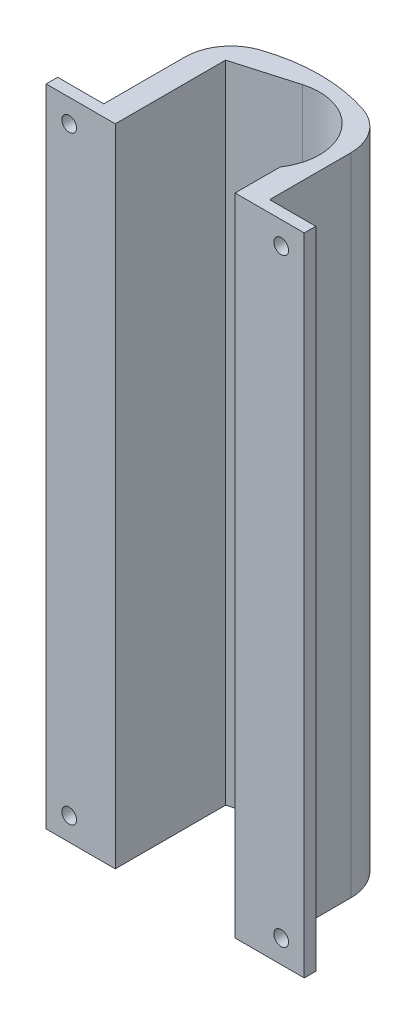
from build123d import *

# Parameters (mm, degrees)
BOSS_EXTRUDE1_DEPTH = 177.8
FILLET2_R           = 12.7
SKETCH2_R           = 2.032
CUT_EXTRUDE1_DEPTH  = 186.827403736


with BuildPart() as part:
    # Sketch1 → Boss-Extrude1 (new body)
    with BuildSketch(Plane(origin=(0, 0, 0), x_dir=(1, 0, 0), z_dir=(0, 1, 0))):
        with BuildLine():
            Line((12.446, -95.666893232), (12.446, -83.267976842))
            ThreePointArc((12.446, -83.267976842), (12.103082443, -66.082532596), (-4.162019583, -60.523437125))
            Line((-4.162019583, -60.523437125), (-20.574, -65.268050741))
            Line((-20.574, -65.268050741), (-20.574, -84.572180345))
            Line((-20.574, -84.572180345), (-20.574, -95.666893232))
            Line((-20.574, -95.666893232), (-39.624, -95.666893232))
            Line((-39.624, -95.666893232), (-39.624, -92.491893232))
            Line((-39.624, -92.491893232), (-26.924, -92.491893232))
            Line((-26.924, -92.491893232), (-26.924, -62.093050741))
            ThreePointArc((-26.924, -62.093050741), (-4.064, -55.764211531), (18.796, -62.093050741))
            Line((18.796, -62.093050741), (18.796, -92.491893232))
            Line((18.796, -92.491893232), (31.496, -92.491893232))
            Line((31.496, -92.491893232), (31.496, -95.666893232))
            Line((31.496, -95.666893232), (12.446, -95.666893232))
        make_face()
    extrude(amount=BOSS_EXTRUDE1_DEPTH)

    # Fillet2
    fillet2_edges = [part.edges().sort_by_distance(p)[0] for p in [
        (-26.924, 88.9, 62.093050741),
        (18.796, 88.9, 62.093050741),
    ]]
    fillet(fillet2_edges, radius=FILLET2_R)

    # Sketch2 → Cut-Extrude1 (cut, through all)
    with BuildSketch(Plane(origin=(0, 0, 92.491893232), x_dir=(-1, 0, 0), z_dir=(0, 0, -1))):
        with Locations((-25.146, 171.45)):
            Circle(SKETCH2_R)
        with Locations((-25.146, 6.35)):
            Circle(SKETCH2_R)
        with Locations((33.274, 171.45)):
            Circle(SKETCH2_R)
        with Locations((33.274, 6.35)):
            Circle(SKETCH2_R)
    extrude(amount=-CUT_EXTRUDE1_DEPTH, mode=Mode.SUBTRACT)


solid = part.part
